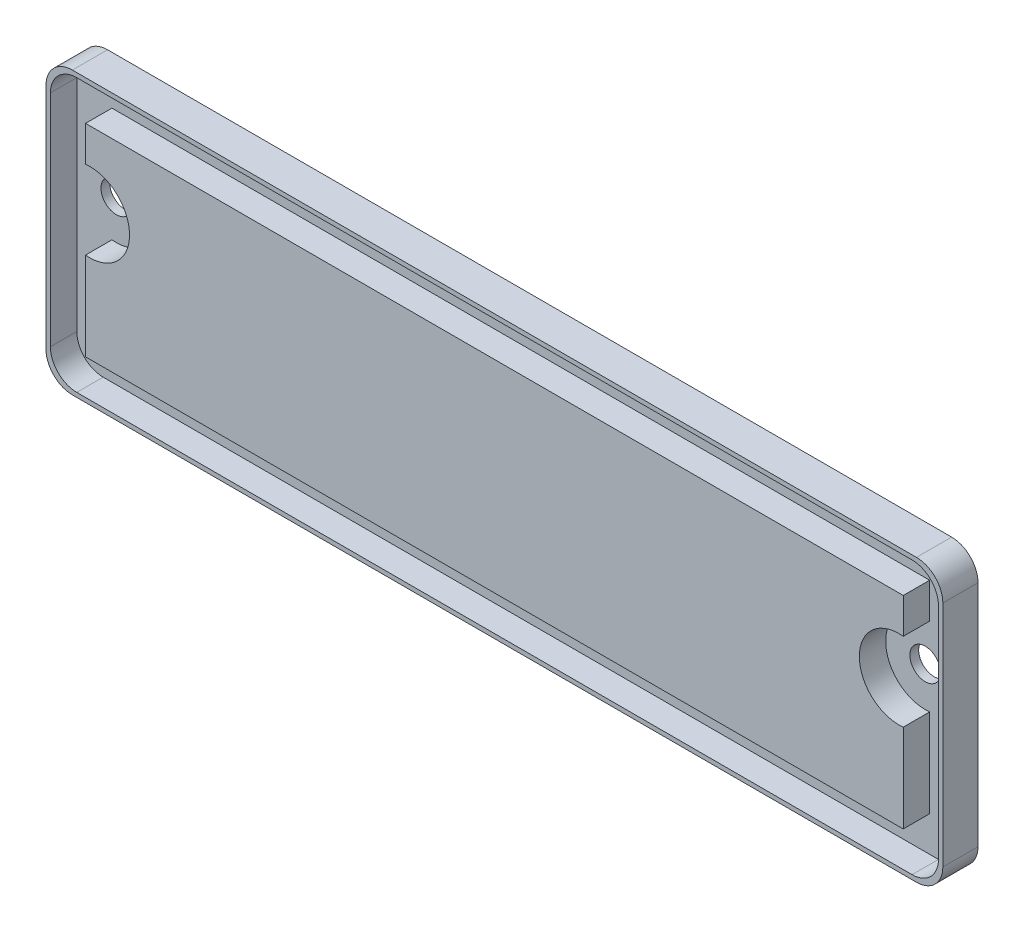
from build123d import *

# Parameters (mm, degrees)
SKETCH1_W           = 102
SKETCH1_H           = 32
BOSS_EXTRUDE1_DEPTH = 1
SKETCH2_W           = 102
SKETCH2_H           = 32
SKETCH2_W_2         = 101
SKETCH2_H_2         = 31
BOSS_EXTRUDE2_DEPTH = 3
SKETCH3_R           = 1.75
CUT_EXTRUDE1_DEPTH  = 107.943910533
FILLET1_R           = 3


with BuildPart() as part:
    # Sketch1 → Boss-Extrude1 (new body)
    with BuildSketch(Plane.XY):
        with Locations((-51, 16)):
            Rectangle(SKETCH1_W, SKETCH1_H)
    extrude(amount=BOSS_EXTRUDE1_DEPTH)

    # Sketch2 → Boss-Extrude2 (add)
    # profile 1 of 2: a face of its own
    with BuildSketch(Plane.XY.offset(1)):
        with Locations((-51, 16)):
            Rectangle(SKETCH2_W, SKETCH2_H)
        with Locations((-51, 16)):
            Rectangle(SKETCH2_W_2, SKETCH2_H_2, mode=Mode.SUBTRACT)
    # profile 2 of 2: a face of its own
    with BuildSketch(Plane.XY.offset(1)):
        with BuildLine():
            Line((-97.5, 14.527864045), (-97.5, 4.5))
            Line((-97.5, 4.5), (-4.5, 4.5))
            Line((-4.5, 4.5), (-4.5, 14.527864045))
            ThreePointArc((-4.5, 14.527864045), (-9.5, 19), (-4.5, 23.472135955))
            Line((-4.5, 23.472135955), (-4.5, 27.5))
            Line((-4.5, 27.5), (-97.5, 27.5))
            Line((-97.5, 27.5), (-97.5, 23.472135955))
            ThreePointArc((-97.5, 23.472135955), (-92.5, 19), (-97.5, 14.527864045))
        make_face()
    extrude(amount=BOSS_EXTRUDE2_DEPTH)

    # Sketch3 → Cut-Extrude1 (cut, through all)
    with BuildSketch(Plane.XY.offset(1)):
        with Locations((-97, 19)):
            Circle(SKETCH3_R)
        with Locations((-5, 19)):
            Circle(SKETCH3_R)
    extrude(amount=-CUT_EXTRUDE1_DEPTH, mode=Mode.SUBTRACT)

    # Fillet1
    fillet1_edges = [part.edges().sort_by_distance(p)[0] for p in [
        (-101.5, 31.5, 2.5),
        (-0.5, 31.5, 2.5),
        (-0.5, 0.5, 2.5),
        (-101.5, 0.5, 2.5),
        (0, 0, 2),
        (-102, 0, 2),
        (-102, 32, 2),
        (0, 32, 2),
    ]]
    fillet(fillet1_edges, radius=FILLET1_R)


solid = part.part
